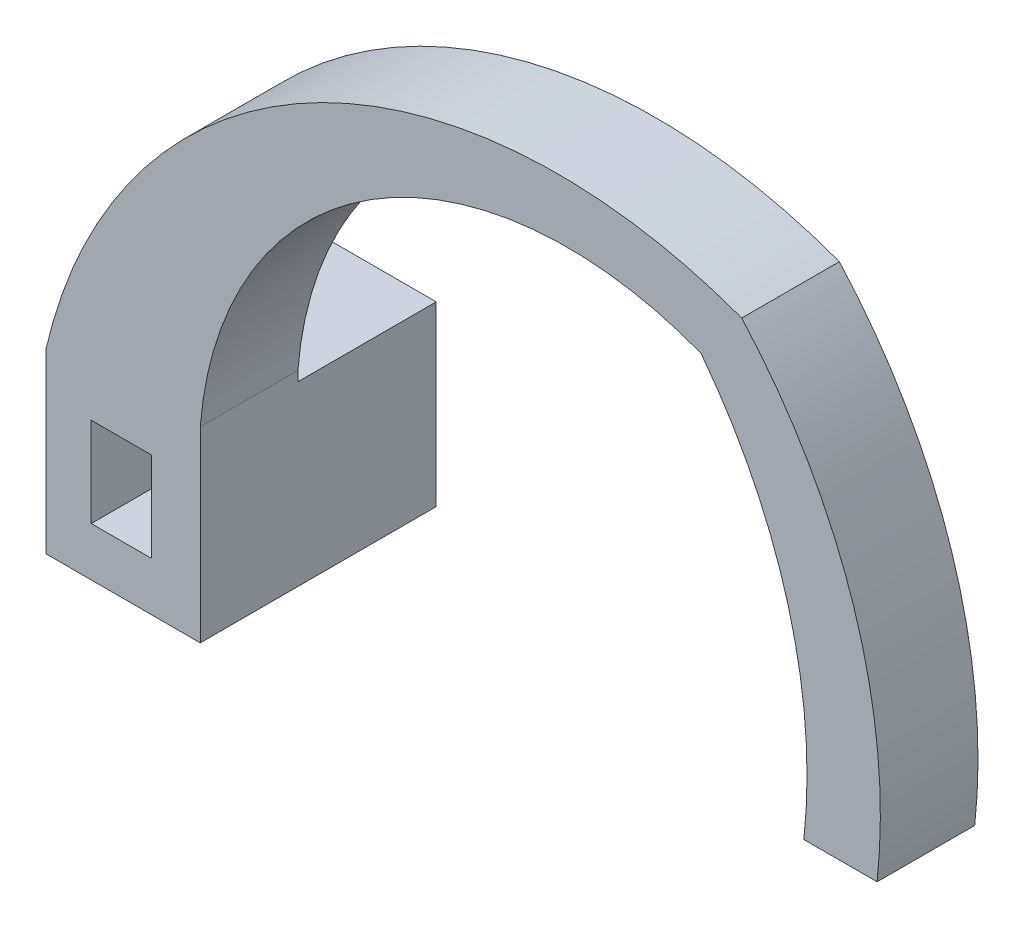
from build123d import *

# Parameters (mm, degrees)
SKETCH1_W           = 3.7
SKETCH1_H           = 5.5
BOSS_EXTRUDE1_DEPTH = 6
SKETCH3_W           = 9.478987056
SKETCH3_H           = 10.898659885
SKETCH3_W_2         = 3.7
SKETCH3_H_2         = 5.5
BOSS_EXTRUDE2_DEPTH = 8.5


with BuildPart() as part:
    # Sketch1 → Boss-Extrude1 (new body)
    with BuildSketch(Plane.XY):
        with BuildLine():
            Line((4.85, 5.75), (4.85, -5.75))
            Line((4.85, -5.75), (-4.628987056, -5.75))
            Line((-4.628987056, -5.75), (-4.628987056, 5.148659885))
            ThreePointArc((-4.628987056, 5.148659885), (11.538438682, 26.332485721), (38.123219895, 28.173556039))
            ThreePointArc((38.123219895, 28.173556039), (45.046416869, 16.141331151), (46.440789316, 2.329712217))
            Line((46.440789316, 2.329712217), (41.93897109, 2.329712217))
            ThreePointArc((41.93897109, 2.329712217), (40.981754891, 14.299726349), (35.619891873, 25.044396012))
            ThreePointArc((35.619891873, 25.044396012), (15.392209294, 23.120190877), (4.85, 5.75))
        make_face()
        Rectangle(SKETCH1_W, SKETCH1_H, mode=Mode.SUBTRACT)
    extrude(amount=BOSS_EXTRUDE1_DEPTH)

    # Sketch3 → Boss-Extrude2 (add)
    with BuildSketch(Plane.XY):
        with Locations((0.110506472, -0.300670057)):
            Rectangle(SKETCH3_W, SKETCH3_H)
        Rectangle(SKETCH3_W_2, SKETCH3_H_2, mode=Mode.SUBTRACT)
    extrude(amount=-BOSS_EXTRUDE2_DEPTH)


solid = part.part
